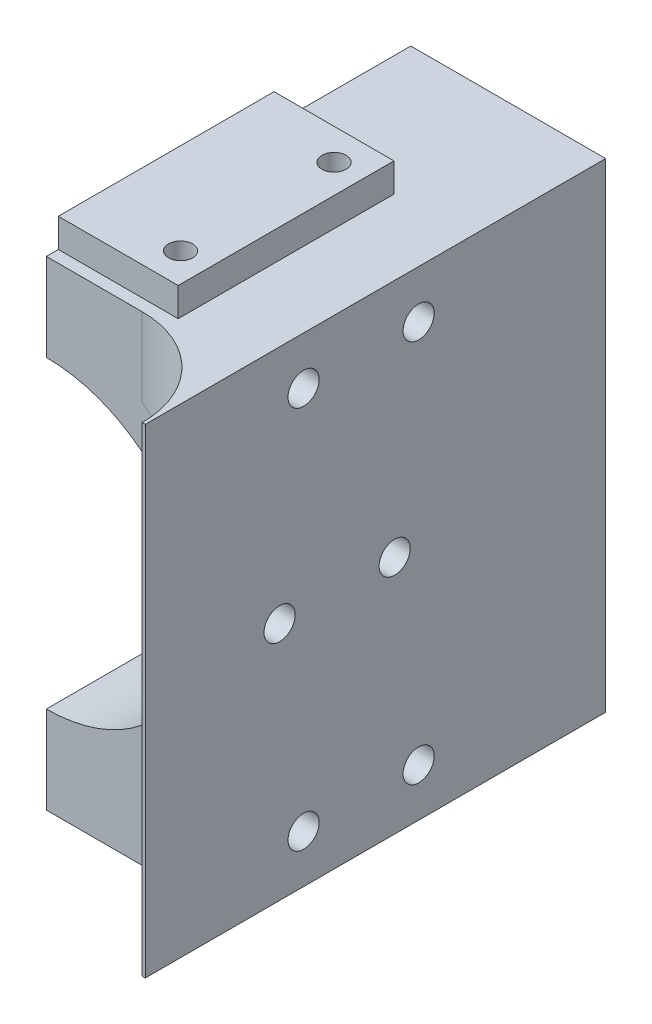
from build123d import *

# Parameters (mm, degrees)
CENTRE_HOLE_FOR_L2_DEPTH      = 40
CENTRE_HOLE_FOR_L2_DEPTH_BACK = 10
SKETCH1_R                     = 39.1
SKETCH1_R_2                   = 31.75
MAIN_STRUCTURE_DEPTH          = 60
MAIN_STRUCTURE_DEPTH_BACK     = 50
SKETCH2_W                     = 100
SKETCH2_H                     = 100
SKETCH2_R                     = 39.1
BEARING_CURVE_DEPTH           = 10
SKETCH6_R                     = 10.5
SHAFT_HOLE_DEPTH              = 10
WRIST_CUTOUT_DEPTH            = 188.082869339
SKETCH11_W                    = 25
SKETCH11_H                    = 45
SKETCH11_R                    = 2.525
BOSS_EXTRUDE1_DEPTH           = 6
CUT_EXTRUDE6_DEPTH            = 168.73789077
CUT_EXTRUDE6_DEPTH_BACK       = 168.73789077
SKETCH18_R                    = 3.25
CUT_EXTRUDE7_START            = -1.5875
CUT_EXTRUDE7_DEPTH            = 1.5875
SKETCH9_R                     = 12.05
BEARING_DEPTH                 = 5
CUT_EXTRUDE8_DEPTH            = 3
SKETCH21_R                    = 3.25
SKETCH21_R_2                  = 1.65
CUT_EXTRUDE9_DEPTH            = 167.868211501
CUT_EXTRUDE10_DEPTH           = 6.35
SKETCH23_R                    = 2.275
CUT_EXTRUDE11_DEPTH           = 6
CHAMFER1_SIZE                 = 0.5
BOSS_EXTRUDE2_DEPTH           = 26


with BuildPart() as part:
    # Sketch1 → Centre Hole for L2 (new, two sides: drawn at the far end of the back side and taken through both)
    with BuildSketch(Plane.XY.offset(-CENTRE_HOLE_FOR_L2_DEPTH_BACK)):
        Circle(SKETCH1_R)
        Circle(SKETCH1_R_2, mode=Mode.SUBTRACT)
    extrude(amount=CENTRE_HOLE_FOR_L2_DEPTH + CENTRE_HOLE_FOR_L2_DEPTH_BACK)

    # Sketch2 → Main Structure (add, two sides: drawn at the far end of the back side and taken through both)
    with BuildSketch(Plane.XY.offset(40).offset(-MAIN_STRUCTURE_DEPTH_BACK)):
        Rectangle(SKETCH2_W, SKETCH2_H)
        Circle(SKETCH2_R, mode=Mode.SUBTRACT)
    extrude(amount=MAIN_STRUCTURE_DEPTH + MAIN_STRUCTURE_DEPTH_BACK)

    # Sketch3 → Bearing Curve (add)
    with BuildSketch(Plane.ZY.offset(50)):
        with BuildLine():
            Line((100, 50), (100, -50))
            ThreePointArc((100, -50), (150, 0), (100, 50))
        make_face()
    bearing_curve = extrude(amount=-BEARING_CURVE_DEPTH)

    # Upright Mirror: Bearing Curve across plane
    add(bearing_curve.mirror(Plane(origin=(0, 0, 0), x_dir=(0, 0, 1), z_dir=(1, 0, 0))))

    # Sketch6 → Shaft Hole (cut)
    with BuildSketch(Plane.ZY.offset(50)):
        with Locations((100, 0)):
            Circle(SKETCH6_R)
    extrude(amount=-SHAFT_HOLE_DEPTH, mode=Mode.SUBTRACT)

    # Sketch4 → Wrist Cutout (cut, through all)
    with BuildSketch(Plane(origin=(0, 50, 0), x_dir=(1, 0, 0), z_dir=(0, 1, 0))):
        with BuildLine():
            Line((-40, -100), (-40, -60))
            ThreePointArc((-40, -60), (-34.142135624, -45.857864376), (-20, -40))
            Line((-20, -40), (20, -40))
            ThreePointArc((20, -40), (34.142135624, -45.857864376), (40, -60))
            Line((40, -60), (40, -100))
            Line((40, -100), (-40, -100))
        make_face()
    extrude(amount=-WRIST_CUTOUT_DEPTH, mode=Mode.SUBTRACT)

    # SurfaceCut1
    split(bisect_by=Plane.ZY, keep=Keep.TOP)

    # Sketch11 → Boss-Extrude1 (add)
    with BuildSketch(Plane(origin=(0, 50, 0), x_dir=(1, 0, 0), z_dir=(0, 1, 0))):
        with Locations((-12.5, -15)):
            Rectangle(SKETCH11_W, SKETCH11_H)
        with Locations(Location((-19, 1, 0), (0, 0, 270))):
            Circle(SKETCH11_R, mode=Mode.SUBTRACT)
        with Locations(Location((-19, -31, 0), (0, 0, 270))):
            Circle(SKETCH11_R, mode=Mode.SUBTRACT)
    extrude(amount=BOSS_EXTRUDE1_DEPTH)

    # Sketch18 → Cut-Extrude6 (cut, two sides: drawn at the far end of the back side and taken through both)
    with BuildSketch(Plane.ZY.offset(50).offset(-CUT_EXTRUDE6_DEPTH_BACK)):
        with Locations((8, 0)):
            Circle(SKETCH18_R)
        with Locations((32, 0)):
            Circle(SKETCH18_R)
    extrude(amount=CUT_EXTRUDE6_DEPTH + CUT_EXTRUDE6_DEPTH_BACK, mode=Mode.SUBTRACT)

    # Sketch19 → Cut-Extrude7 (cut)
    with BuildSketch(Plane(origin=(-40, 0, 0), x_dir=(0, 0, -1), z_dir=(1, 0, 0)).offset(CUT_EXTRUDE7_START)):
        with BuildLine():
            Line((-60, 50), (-100, 50))
            ThreePointArc((-100, 50), (-150, 0), (-100, -50))
            Line((-100, -50), (-60, -50))
            Line((-60, -50), (-60, 50))
        make_face()
    extrude(amount=CUT_EXTRUDE7_DEPTH, mode=Mode.SUBTRACT)

    # Sketch9 → Bearing (cut)
    with BuildSketch(Plane(origin=(-41.5875, 0, 0), x_dir=(0, 0, -1), z_dir=(1, 0, 0))):
        with Locations((-100, 0)):
            Circle(SKETCH9_R)
    extrude(amount=-BEARING_DEPTH, mode=Mode.SUBTRACT)

    # Sketch20 → Cut-Extrude8 (cut)
    with BuildSketch(Plane.ZY.offset(50)):
        with BuildLine():
            Line((-10, -50), (100, -50))
            ThreePointArc((100, -50), (150, 0), (100, 50))
            Line((100, 50), (-10, 50))
            Line((-10, 50), (-10, -50))
        make_face()
    extrude(amount=-CUT_EXTRUDE8_DEPTH, mode=Mode.SUBTRACT)

    # Sketch21 → Cut-Extrude9 (cut, through all)
    with BuildSketch(Plane.ZY.offset(47)):
        with Locations((3, -40)):
            Circle(SKETCH21_R)
        with Locations((27, -40)):
            Circle(SKETCH21_R)
        with Locations(Location((27, 40, 0), (0, 0, 180))):
            Circle(SKETCH21_R)
        with Locations(Location((3, 40, 0), (0, 0, 180))):
            Circle(SKETCH21_R)
        with Locations((125, 0)):
            Circle(SKETCH21_R_2)
    extrude(amount=-CUT_EXTRUDE9_DEPTH, mode=Mode.SUBTRACT)

    # Sketch22 → Cut-Extrude10 (cut)
    with BuildSketch(Plane.ZY.offset(47)):
        with BuildLine():
            Line((-10, 50), (-10, -50))
            Line((-10, -50), (100, -50))
            ThreePointArc((100, -50), (150, 0), (100, 50))
            Line((100, 50), (-10, 50))
        make_face()
    extrude(amount=-CUT_EXTRUDE10_DEPTH, mode=Mode.SUBTRACT)

    # Sketch23 → Cut-Extrude11 (cut)
    with BuildSketch(Plane(origin=(0, -50, 0), x_dir=(-1, 0, 0), z_dir=(0, -1, 0))):
        with Locations(Location((15, 3.25, 0), (0, 0, 90))):
            Circle(SKETCH23_R)
    extrude(amount=-CUT_EXTRUDE11_DEPTH, mode=Mode.SUBTRACT)

    # Chamfer1
    chamfer1_edges = [part.edges().sort_by_distance(p)[0] for p in [
        (-15, -50, -0.975),
    ]]
    chamfer(chamfer1_edges, length=CHAMFER1_SIZE)


with BuildPart() as body_2:
    # Mirror1: mirrored copy
    add(part.part.mirror(Plane.ZY))

    # Sketch24 → Boss-Extrude2 (add)
    with BuildSketch(Plane(origin=(0, 0, -10), x_dir=(-1, 0, 0), z_dir=(0, 0, -1))):
        with BuildLine():
            Line((-40.65, 50), (-40.65, -50))
            Line((-40.65, -50), (0, -50))
            Line((0, -50), (0, -31.75))
            ThreePointArc((0, -31.75), (-31.75, 0), (0, 31.75))
            Line((0, 31.75), (0, 50))
            Line((0, 50), (-40.65, 50))
        make_face()
    extrude(amount=BOSS_EXTRUDE2_DEPTH)


solid = body_2.part
